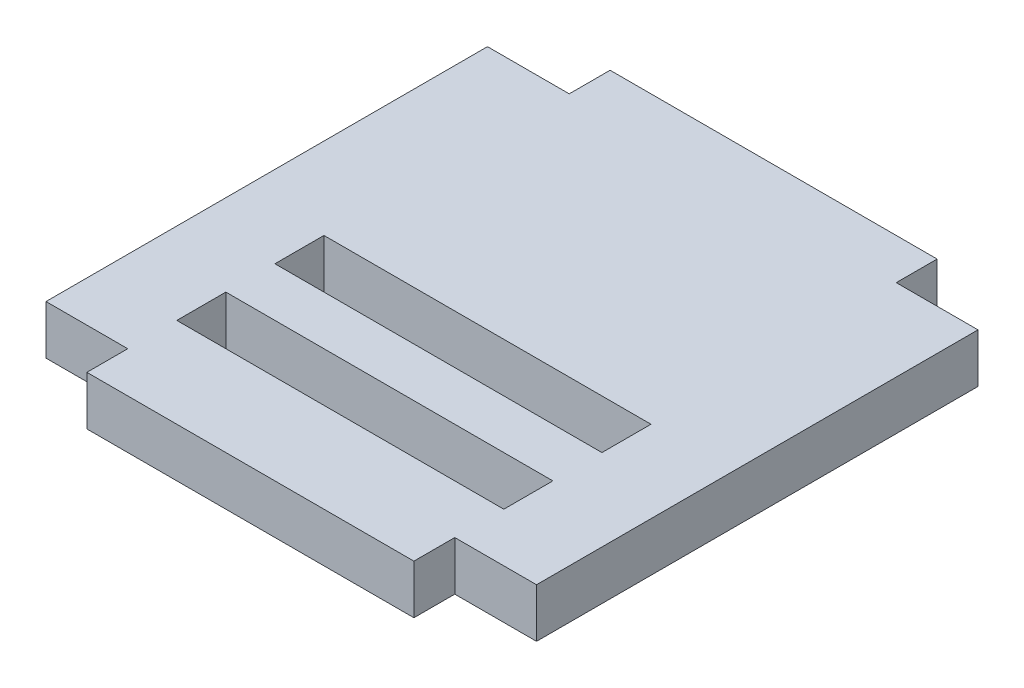
from build123d import *

# Parameters (mm, degrees)
SKETCH_1_W          = 20
SKETCH_1_H          = 2.5
SKETCH_1_W_2        = 30
SKETCH_1_H_2        = 27
EXTRUDE_1_DEPTH     = 3
SKETCH_2_W          = 20
SKETCH_2_H          = 3
CUT_EXTRUDE_1_DEPTH = 23.135943621


with BuildPart() as part:
    # 草图1 → 凸台-拉伸1 (new body)
    with BuildSketch(Plane(origin=(0, 0, 0), x_dir=(1, 0, 0), z_dir=(0, 1, 0))):
        with Locations((0, 14.75)):
            Rectangle(SKETCH_1_W, SKETCH_1_H)
        Rectangle(SKETCH_1_W_2, SKETCH_1_H_2)
        with Locations((0, -14.75)):
            Rectangle(SKETCH_1_W, SKETCH_1_H)
    extrude(amount=EXTRUDE_1_DEPTH)

    # 草图2 → 切除-拉伸1 (cut, through all)
    with BuildSketch(Plane(origin=(0, 3, 0), x_dir=(1, 0, 0), z_dir=(0, 1, 0))):
        with Locations((0, -9)):
            Rectangle(SKETCH_2_W, SKETCH_2_H)
        with Locations((0, -3)):
            Rectangle(SKETCH_2_W, SKETCH_2_H)
    extrude(amount=-CUT_EXTRUDE_1_DEPTH, mode=Mode.SUBTRACT)


solid = part.part
